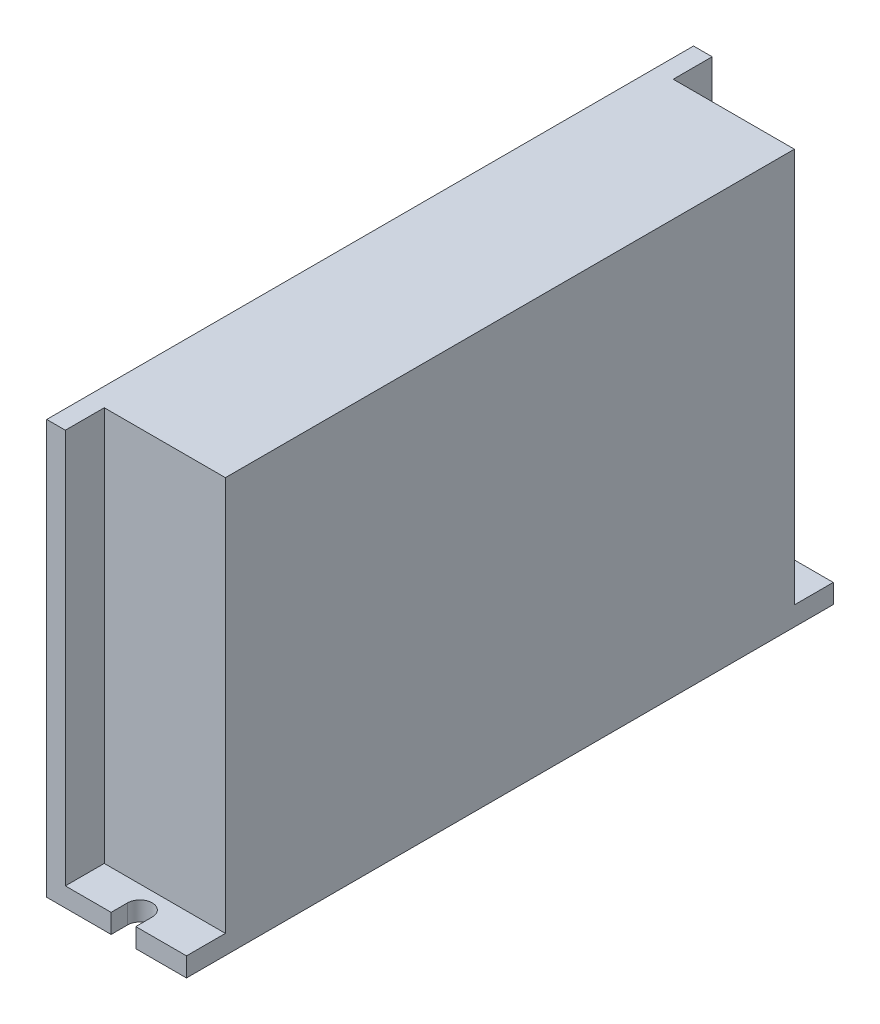
from build123d import *

# Parameters (mm, degrees)
SKETCH2_W           = 25.5
SKETCH2_H           = 118
BOSS_EXTRUDE3_DEPTH = 3.5
CUT_EXTRUDE1_DEPTH  = 61.463315324
SKETCH4_W           = 3.4
SKETCH4_H           = 118
BOSS_EXTRUDE4_DEPTH = 72
SKETCH5_W           = 22.1
SKETCH5_H           = 103.8
BOSS_EXTRUDE5_DEPTH = 72


with BuildPart() as part:
    # Sketch2 → Boss-Extrude3 (new body)
    with BuildSketch(Plane(origin=(0, 0, 0), x_dir=(1, 0, 0), z_dir=(0, 1, 0))):
        Rectangle(SKETCH2_W, SKETCH2_H)
    extrude(amount=BOSS_EXTRUDE3_DEPTH)

    # Sketch3 → Cut-Extrude1 (cut, through all)
    with BuildSketch(Plane(origin=(0, 3.5, 0), x_dir=(1, 0, 0), z_dir=(0, 1, 0))):
        with BuildLine():
            Line((-1, 56), (-1, 59))
            Line((-1, 59), (3.5, 59))
            Line((3.5, 59), (3.5, 56))
            ThreePointArc((3.5, 56), (1.25, 53.75), (-1, 56))
        make_face()
        with BuildLine():
            Line((-1, -56), (-1, -59))
            Line((-1, -59), (3.5, -59))
            Line((3.5, -59), (3.5, -56))
            ThreePointArc((3.5, -56), (1.25, -53.75), (-1, -56))
        make_face()
    extrude(amount=-CUT_EXTRUDE1_DEPTH, mode=Mode.SUBTRACT)

    # Sketch4 → Boss-Extrude4 (add)
    with BuildSketch(Plane(origin=(0, 3.5, 0), x_dir=(1, 0, 0), z_dir=(0, 1, 0))):
        with Locations((-11.05, 0)):
            Rectangle(SKETCH4_W, SKETCH4_H)
    extrude(amount=BOSS_EXTRUDE4_DEPTH)

    # Sketch5 → Boss-Extrude5 (add)
    with BuildSketch(Plane(origin=(0, 3.5, 0), x_dir=(1, 0, 0), z_dir=(0, 1, 0))):
        with Locations((1.7, 0)):
            Rectangle(SKETCH5_W, SKETCH5_H)
    extrude(amount=BOSS_EXTRUDE5_DEPTH)


solid = part.part
